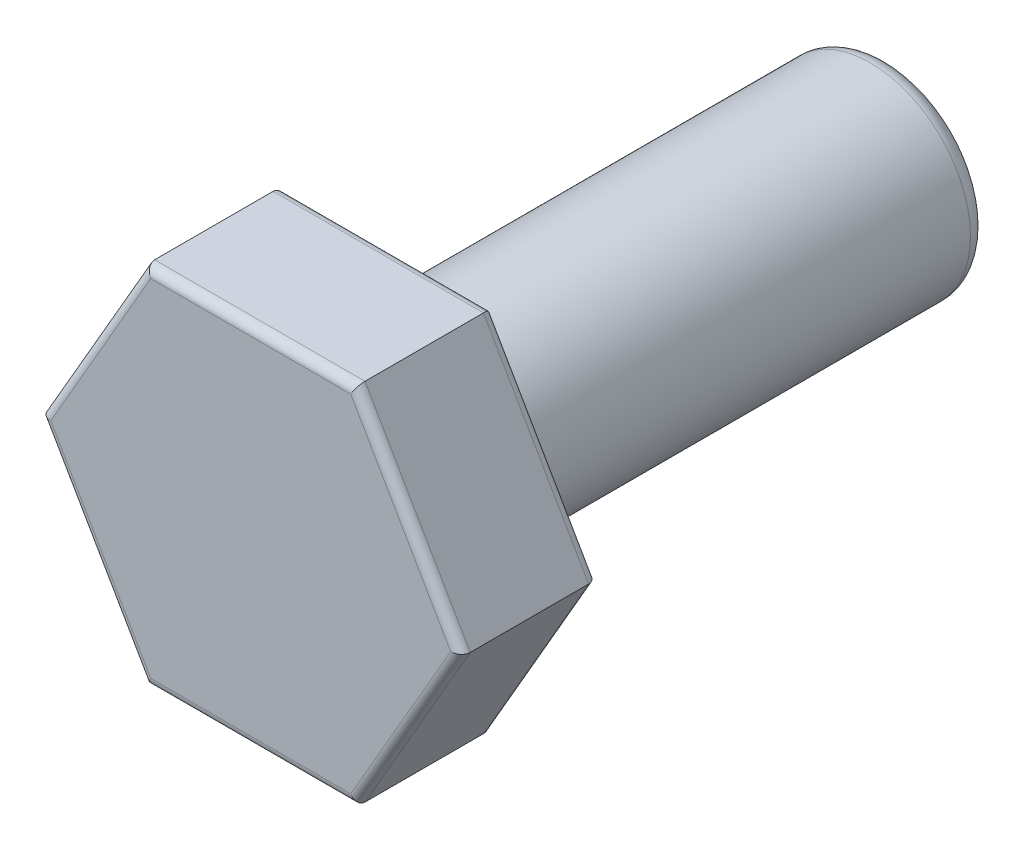
from build123d import *

# Parameters (mm, degrees)
SKETCH_1_R      = 11
EXTRUDE_1_DEPTH = 55
EXTRUDE_2_DEPTH = 15
FILLET_1_R      = 1
FILLET_2_R      = 2


with BuildPart() as part:
    # 草图1 → 凸台-拉伸1 (new body)
    with BuildSketch(Plane.XY):
        Circle(SKETCH_1_R)
    extrude(amount=EXTRUDE_1_DEPTH)

    # 草图2 → 凸台-拉伸2 (add)
    with BuildSketch(Plane.XY.offset(55)):
        Polygon((11.547005384, -20), (23.094010768, 0), (11.547005384, 20), (-11.547005384, 20), (-23.094010768, 0), (-11.547005384, -20), align=None)
    extrude(amount=EXTRUDE_2_DEPTH)

    # 圆角1
    fillet_1_edges = [part.edges().sort_by_distance(p)[0] for p in [
        (0, -20, 55),
        (17.320508076, -10, 55),
        (17.320508076, 10, 55),
        (0, 20, 55),
        (-17.320508076, 10, 55),
        (-17.320508076, -10, 55),
        (0, -20, 70),
        (17.320508076, -10, 70),
        (17.320508076, 10, 70),
        (0, 20, 70),
        (-17.320508076, 10, 70),
        (-17.320508076, -10, 70),
    ]]
    fillet(fillet_1_edges, radius=FILLET_1_R)

    # 圆角2
    fillet_2_edges = [part.edges().sort_by_distance(p)[0] for p in [
        (-11, 0, 0),
    ]]
    fillet(fillet_2_edges, radius=FILLET_2_R)


solid = part.part
